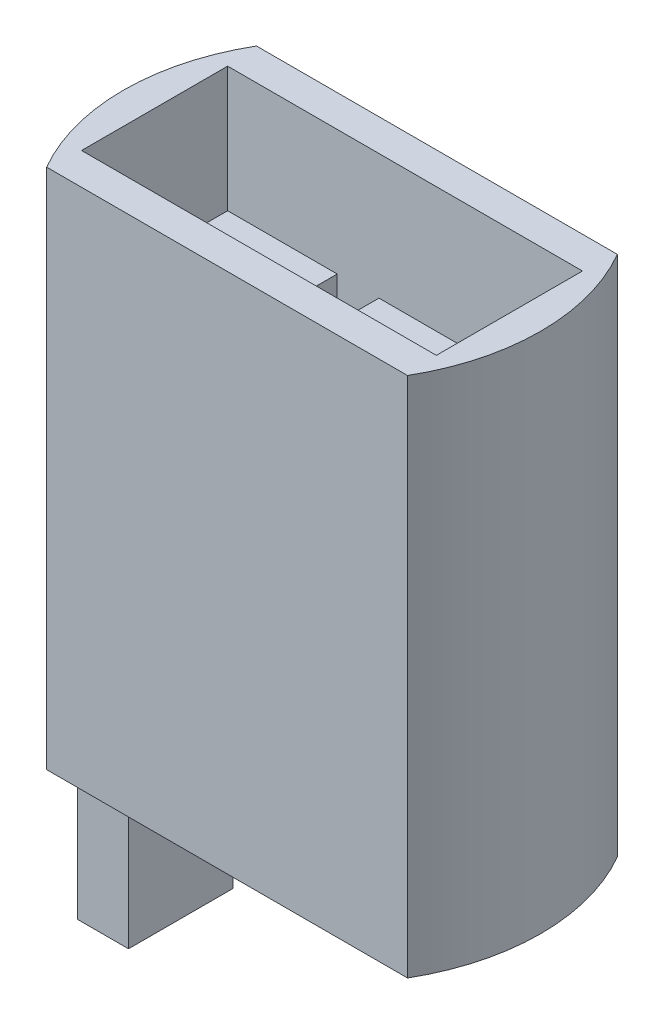
from build123d import *

# Parameters (mm, degrees)
SKETCH1_R           = 10
BOSS_EXTRUDE1_DEPTH = 25
SKETCH2_W           = 1.25
SKETCH2_H           = 5
BOSS_EXTRUDE2_DEPTH = 8
BOSS_EXTRUDE3_DEPTH = 1.2
SKETCH4_W           = 17
SKETCH4_H           = 7
CUT_EXTRUDE1_DEPTH  = 6
SKETCH5_W           = 2
SKETCH5_H           = 7
CUT_EXTRUDE2_DEPTH  = 4
CUT_EXTRUDE3_DEPTH  = 25


with BuildPart() as part:
    # Sketch1 → Boss-Extrude1 (new body)
    with BuildSketch(Plane(origin=(0, 0, 0), x_dir=(1, 0, 0), z_dir=(0, 1, 0))):
        with Locations(Location((0, 0, 0), (0, 0, 270))):
            Circle(SKETCH1_R)
    extrude(amount=BOSS_EXTRUDE1_DEPTH)

    # Sketch4 → Cut-Extrude1 (cut)
    with BuildSketch(Plane(origin=(0, 25, 0), x_dir=(1, 0, 0), z_dir=(0, 1, 0))):
        Rectangle(SKETCH4_W, SKETCH4_H)
    extrude(amount=-CUT_EXTRUDE1_DEPTH, mode=Mode.SUBTRACT)

    # Sketch5 → Cut-Extrude2 (cut)
    with BuildSketch(Plane(origin=(0, 19, 0), x_dir=(1, 0, 0), z_dir=(0, 1, 0))):
        with Locations((-2.25, 0)):
            Rectangle(SKETCH5_W, SKETCH5_H)
    extrude(amount=-CUT_EXTRUDE2_DEPTH, mode=Mode.SUBTRACT)

    # Sketch6 → Cut-Extrude3 (cut)
    with BuildSketch(Plane.XZ):
        with BuildLine():
            Line((-8.644632716, 5.026959838), (8.644632716, 5.026959838))
            ThreePointArc((8.644632716, 5.026959838), (0, 10), (-8.644632716, 5.026959838))
        make_face()
        with BuildLine():
            Line((-8.644632716, -5.026959838), (8.644632716, -5.026959838))
            ThreePointArc((8.644632716, -5.026959838), (0, -10), (-8.644632716, -5.026959838))
        make_face()
    extrude(amount=-CUT_EXTRUDE3_DEPTH, mode=Mode.SUBTRACT)


with BuildPart() as body_2:
    # Sketch2 → Boss-Extrude2 (new body)
    with BuildSketch(Plane(origin=(0, 0, 0), x_dir=(-1, 0, 0), z_dir=(0, -1, 0))):
        with Locations((7.875, 0)):
            Rectangle(SKETCH2_W, SKETCH2_H)
    extrude(amount=BOSS_EXTRUDE2_DEPTH)

    # Sketch3 → Boss-Extrude3 (add)
    with BuildSketch(Plane.ZY.offset(8.5)):
        Polygon((-2.5, -8), (-2.5, 0), (2.5, 0), (2.5, -8), (1.5, -8), (1.5, -0.75), (-1.5, -0.75), (-1.5, -8), align=None)
    extrude(amount=BOSS_EXTRUDE3_DEPTH)


solid = Compound([part.part, body_2.part])
